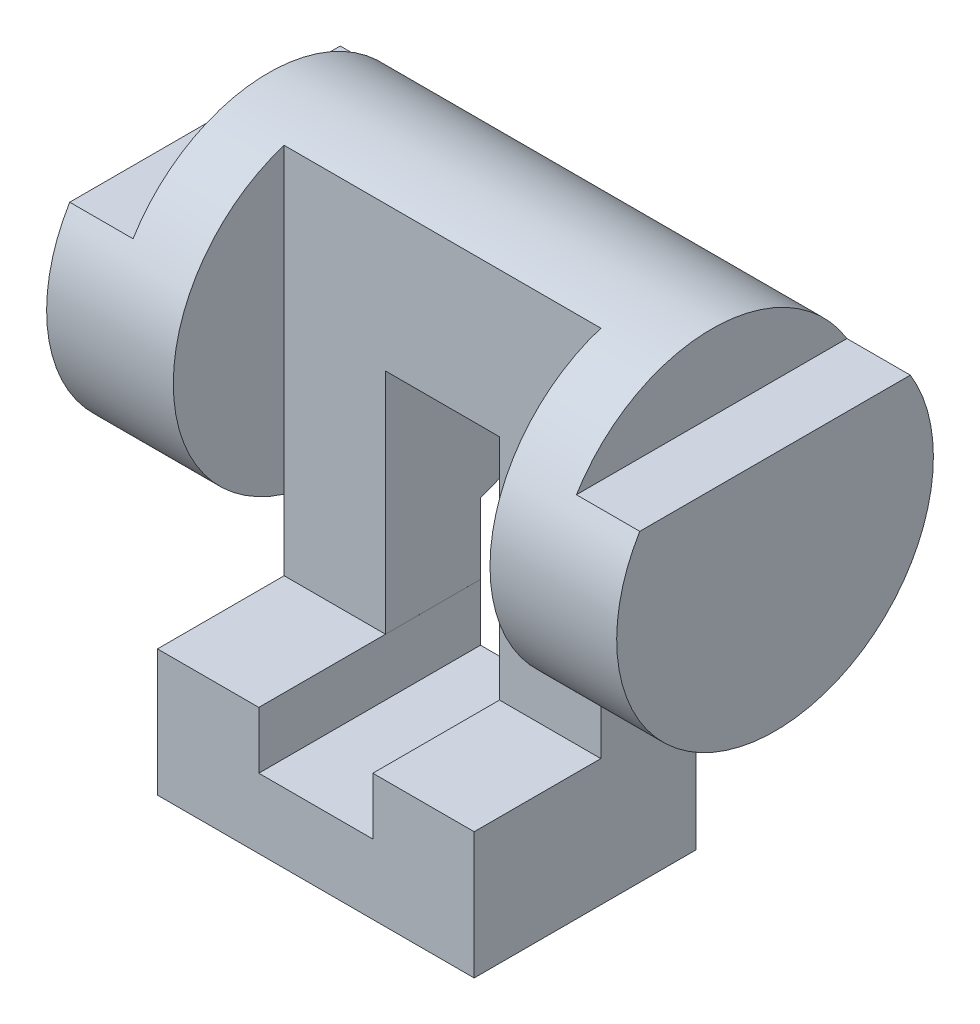
from build123d import *

# Parameters (mm, degrees)
EXTRUDE_1_DEPTH     = 35
EXTRUDE_START       = 25
SKETCH_2_R          = 25
EXTRUDE_3_DEPTH     = 45
SKETCH_3_W          = 15
SKETCH_3_H          = 35
EXTRUDE_4_DEPTH     = 50
SKETCH_4_W          = 20
SKETCH_4_H          = 60
CUT_EXTRUDE_1_DEPTH = 50
SKETCH_10_W         = 18
SKETCH_10_H         = 45
CUT_EXTRUDE_3_DEPTH = 60
SKETCH_12_W         = 10
SKETCH_12_H         = 12
CUT_EXTRUDE_5_DEPTH = 60


with BuildPart() as part:
    # Эскиз1 → Бобышка-Вытянуть1 (new body)
    with BuildSketch(Plane.XY):
        Polygon((0, 0), (50, 0), (50, 20), (34, 20), (34, 11), (16, 11), (16, 19.999701213), (0, 19.999701213), align=None)
    extrude(amount=-EXTRUDE_1_DEPTH)



with BuildPart() as body_2:
    # Эскиз2 → Бобышка-Вытянуть3 (new, symmetric)
    with BuildSketch(Plane(origin=(0, 0, 0), x_dir=(0, 0, -1), z_dir=(1, 0, 0)).offset(EXTRUDE_START)):
        with Locations((27.5, 55)):
            Circle(SKETCH_2_R)
    extrude(amount=EXTRUDE_3_DEPTH, both=True)


with BuildPart() as part_1:
    add(part.part)

    add(body_2.part)  # Бобышка-Вытянуть4 merges body 2
    # Эскиз3 → Бобышка-Вытянуть4 (add)
    with BuildSketch(Plane(origin=(0, 0, 0), x_dir=(0, 0, -1), z_dir=(1, 0, 0))):
        with Locations((27.5, 37.5)):
            Rectangle(SKETCH_3_W, SKETCH_3_H)
    extrude(amount=EXTRUDE_4_DEPTH)

    # Эскиз4 → Вырез-Вытянуть1 (cut)
    with BuildSketch(Plane(origin=(0, 0, 0), x_dir=(0, 0, -1), z_dir=(1, 0, 0))):
        with Locations((10, 50)):
            Rectangle(SKETCH_4_W, SKETCH_4_H)
    extrude(amount=CUT_EXTRUDE_1_DEPTH, mode=Mode.SUBTRACT)

    # Эскиз10 → Вырез-Вытянуть3 (cut)
    with BuildSketch(Plane.XY):
        with Locations((25, 33.5)):
            Rectangle(SKETCH_10_W, SKETCH_10_H)
    extrude(amount=-CUT_EXTRUDE_3_DEPTH, mode=Mode.SUBTRACT)

    # Эскиз12 → Вырез-Вытянуть5 (cut)
    with BuildSketch(Plane.XY):
        with Locations((-15, 74)):
            Rectangle(SKETCH_12_W, SKETCH_12_H)
        with Locations((65, 74)):
            Rectangle(SKETCH_12_W, SKETCH_12_H)
    extrude(amount=-CUT_EXTRUDE_5_DEPTH, mode=Mode.SUBTRACT)


solid = part_1.part
